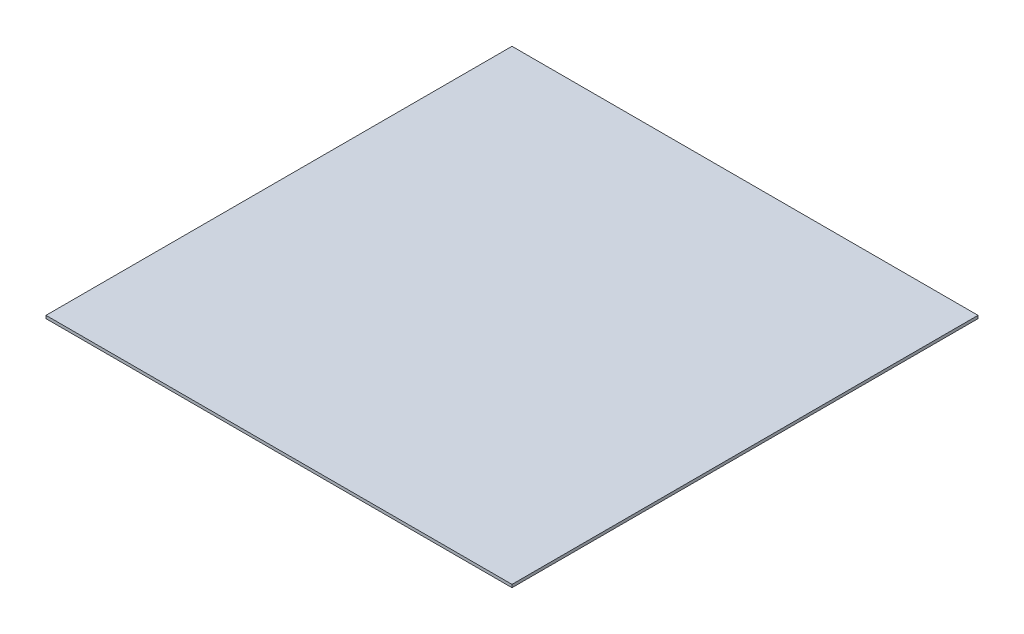
from build123d import *

# Parameters (mm, degrees)
SKETCH1_W           = 80
SKETCH1_H           = 80
BOSS_EXTRUDE1_DEPTH = 0.25


with BuildPart() as part:
    # Sketch1 → Boss-Extrude1 (new, symmetric)
    with BuildSketch(Plane(origin=(0, 0, 0), x_dir=(1, 0, 0), z_dir=(0, 1, 0))):
        Rectangle(SKETCH1_W, SKETCH1_H)
    extrude(amount=BOSS_EXTRUDE1_DEPTH, both=True)


solid = part.part
